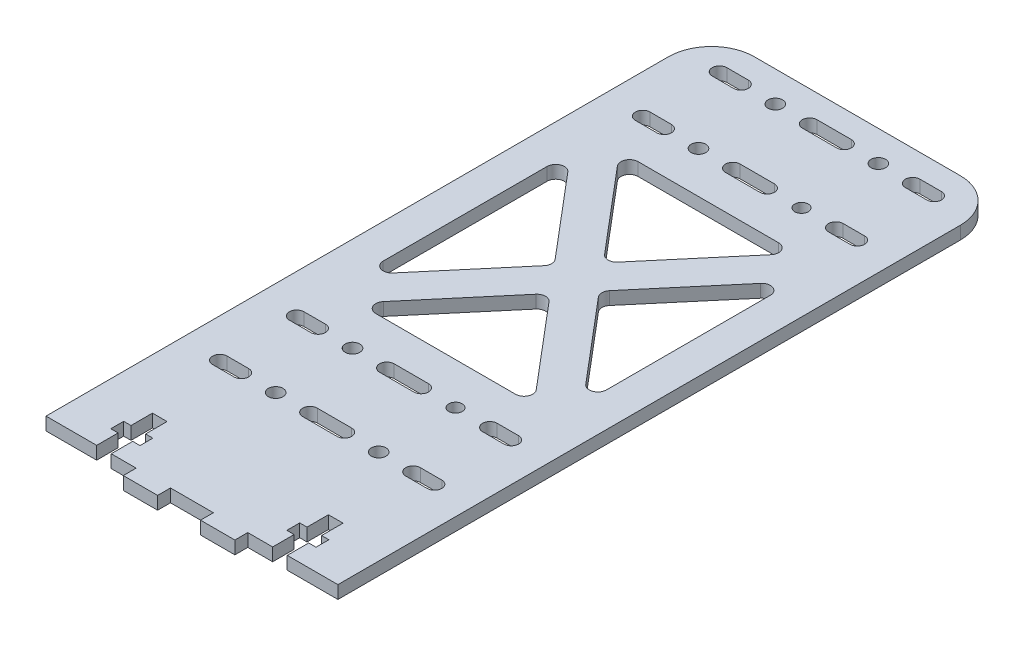
from build123d import *

# Parameters (mm, degrees)
EXTRUDE_1_DEPTH     = 3
SKETCH_2_R          = 1.7
SKETCH_2_R_2        = 1.57
CUT_EXTRUDE_1_DEPTH = 3
SKETCH_3_W          = 60
SKETCH_3_H          = 3
EXTRUDE_2_DEPTH     = 5
SKETCH_6_W          = 155
SKETCH_6_H          = 3
EXTRUDE_3_DEPTH     = 4
SKETCH_7_W          = 155
SKETCH_7_H          = 3
EXTRUDE_4_DEPTH     = 4
FILLET_1_R          = 10
CUT_EXTRUDE_3_DEPTH = 4
FILLET_3_R          = 2


with BuildPart() as part:
    # 草图1 → 凸台-拉伸1 (new body)
    with BuildSketch(Plane(origin=(0, 0, 0), x_dir=(1, 0, 0), z_dir=(0, 1, 0))):
        Polygon((0, 0), (7.8, 0), (7.8, 5), (6.1, 5), (6.1, 8), (7.8, 8), (7.8, 13), (11.2, 13), (11.2, 8), (12.9, 8), (12.9, 5), (11.2, 5), (11.2, 0), (17, 0), (17, -3), (25, -3), (25, 0), (31.7, 0), (35, 0), (35, -3), (43, -3), (43, 0), (48.8, 0), (48.8, 5), (47.1, 5), (47.1, 8), (48.8, 8), (48.8, 13), (52.2, 13), (52.2, 8), (53.9, 8), (53.9, 5), (52.2, 5), (52.2, 0), (60, 0), (60, 150), (0, 150), align=None)
    extrude(amount=EXTRUDE_1_DEPTH)

    # 草图2 → 切除-拉伸1 (cut)
    with BuildSketch(Plane(origin=(0, 3, 0), x_dir=(1, 0, 0), z_dir=(0, 1, 0))):
        with Locations(Location((18, 130, 0), (0, 0, 270))):
            Circle(SKETCH_2_R)
        with Locations(Location((42, 130, 0), (0, 0, 270))):
            Circle(SKETCH_2_R_2)
        with Locations(Location((18, 147.9, 0), (0, 0, 270))):
            Circle(SKETCH_2_R)
        with Locations(Location((42, 147.9, 0), (0, 0, 270))):
            Circle(SKETCH_2_R)
        with Locations(Location((42, 31.5, 0), (0, 0, 90))):
            Circle(SKETCH_2_R)
        with Locations(Location((18, 31.5, 0), (0, 0, 90))):
            Circle(SKETCH_2_R)
        with Locations(Location((42, 49.4, 0), (0, 0, 90))):
            Circle(SKETCH_2_R_2)
        with Locations(Location((18, 49.4, 0), (0, 0, 90))):
            Circle(SKETCH_2_R)
        with BuildLine():
            Line((5, 131.7), (10, 131.7))
            ThreePointArc((10, 131.7), (11.7, 130), (10, 128.3))
            Line((10, 128.3), (5, 128.3))
            ThreePointArc((5, 128.3), (3.3, 130), (5, 131.7))
        make_face()
        with BuildLine():
            Line((26, 131.7), (34, 131.7))
            ThreePointArc((34, 131.7), (35.7, 130), (34, 128.3))
            Line((34, 128.3), (26, 128.3))
            ThreePointArc((26, 128.3), (24.3, 130), (26, 131.7))
        make_face()
        with BuildLine():
            Line((50, 131.7), (55, 131.7))
            ThreePointArc((55, 131.7), (56.7, 130), (55, 128.3))
            Line((55, 128.3), (50, 128.3))
            ThreePointArc((50, 128.3), (48.3, 130), (50, 131.7))
        make_face()
        with BuildLine():
            Line((5, 149.6), (10, 149.6))
            ThreePointArc((10, 149.6), (11.7, 147.9), (10, 146.2))
            Line((10, 146.2), (5, 146.2))
            ThreePointArc((5, 146.2), (3.3, 147.9), (5, 149.6))
        make_face()
        with BuildLine():
            Line((26, 149.6), (34, 149.6))
            ThreePointArc((34, 149.6), (35.7, 147.9), (34, 146.2))
            Line((34, 146.2), (26, 146.2))
            ThreePointArc((26, 146.2), (24.3, 147.9), (26, 149.6))
        make_face()
        with BuildLine():
            Line((50, 149.6), (55, 149.6))
            ThreePointArc((55, 149.6), (56.7, 147.9), (55, 146.2))
            Line((55, 146.2), (50, 146.2))
            ThreePointArc((50, 146.2), (48.3, 147.9), (50, 149.6))
        make_face()
        with BuildLine():
            Line((5, 47.7), (10, 47.7))
            ThreePointArc((10, 47.7), (11.7, 49.4), (10, 51.1))
            Line((10, 51.1), (5, 51.1))
            ThreePointArc((5, 51.1), (3.3, 49.4), (5, 47.7))
        make_face()
        with BuildLine():
            Line((26, 47.7), (34, 47.7))
            ThreePointArc((34, 47.7), (35.7, 49.4), (34, 51.1))
            Line((34, 51.1), (26, 51.1))
            ThreePointArc((26, 51.1), (24.3, 49.4), (26, 47.7))
        make_face()
        with BuildLine():
            Line((50, 47.7), (55, 47.7))
            ThreePointArc((55, 47.7), (56.7, 49.4), (55, 51.1))
            Line((55, 51.1), (50, 51.1))
            ThreePointArc((50, 51.1), (48.3, 49.4), (50, 47.7))
        make_face()
        with BuildLine():
            Line((5, 29.8), (10, 29.8))
            ThreePointArc((10, 29.8), (11.7, 31.5), (10, 33.2))
            Line((10, 33.2), (5, 33.2))
            ThreePointArc((5, 33.2), (3.3, 31.5), (5, 29.8))
        make_face()
        with BuildLine():
            Line((26, 29.8), (34, 29.8))
            ThreePointArc((34, 29.8), (35.7, 31.5), (34, 33.2))
            Line((34, 33.2), (26, 33.2))
            ThreePointArc((26, 33.2), (24.3, 31.5), (26, 29.8))
        make_face()
        with BuildLine():
            Line((50, 29.8), (55, 29.8))
            ThreePointArc((55, 29.8), (56.7, 31.5), (55, 33.2))
            Line((55, 33.2), (50, 33.2))
            ThreePointArc((50, 33.2), (48.3, 31.5), (50, 29.8))
        make_face()
    extrude(amount=-CUT_EXTRUDE_1_DEPTH, mode=Mode.SUBTRACT)

    # 草图3 → 凸台-拉伸2 (add)
    with BuildSketch(Plane(origin=(0, 0, -150), x_dir=(-1, 0, 0), z_dir=(0, 0, -1))):
        with Locations((-30, 1.5)):
            Rectangle(SKETCH_3_W, SKETCH_3_H)
    extrude(amount=EXTRUDE_2_DEPTH)

    # 草图6 → 凸台-拉伸3 (add)
    with BuildSketch(Plane(origin=(60, 0, 0), x_dir=(0, 0, -1), z_dir=(1, 0, 0))):
        with Locations((77.5, 1.5)):
            Rectangle(SKETCH_6_W, SKETCH_6_H)
    extrude(amount=EXTRUDE_3_DEPTH)

    # 草图7 → 凸台-拉伸4 (add)
    with BuildSketch(Plane.ZY):
        with Locations((-77.5, 1.5)):
            Rectangle(SKETCH_7_W, SKETCH_7_H)
    extrude(amount=EXTRUDE_4_DEPTH)

    # 圆角1
    fillet_1_edges = [part.edges().sort_by_distance(p)[0] for p in [
        (64, 1.5, -155),
        (-4, 1.5, -155),
    ]]
    fillet(fillet_1_edges, radius=FILLET_1_R)

    # 草图9 → 切除-拉伸3 (cut)
    with BuildSketch(Plane(origin=(0, 3, 0), x_dir=(1, 0, 0), z_dir=(0, 1, 0))):
        Polygon((9.322748518, 120.3), (50.677251482, 120.3), (30, 95.845173728), align=None)
        Polygon((4, 114.204826272), (4, 65.095173728), (24.761804328, 89.65), align=None)
        Polygon((9.407301363, 59.1), (50.592698637, 59.1), (30, 83.454826272), align=None)
        Polygon((56, 114.204826272), (56, 65.095173728), (35.238195672, 89.65), align=None)
    extrude(amount=-CUT_EXTRUDE_3_DEPTH, mode=Mode.SUBTRACT)

    # 圆角3
    fillet_3_edges = [part.edges().sort_by_distance(p)[0] for p in [
        (30, 1.5, -83.454826272),
        (50.592698637, 1.5, -59.1),
        (9.407301363, 1.5, -59.1),
        (56, 1.5, -65.095173728),
        (35.238195672, 1.5, -89.65),
        (56, 1.5, -114.204826272),
        (4, 1.5, -114.204826272),
        (24.761804328, 1.5, -89.65),
        (4, 1.5, -65.095173728),
        (50.677251482, 1.5, -120.3),
        (30, 1.5, -95.845173728),
        (9.322748518, 1.5, -120.3),
    ]]
    fillet(fillet_3_edges, radius=FILLET_3_R)


solid = part.part
